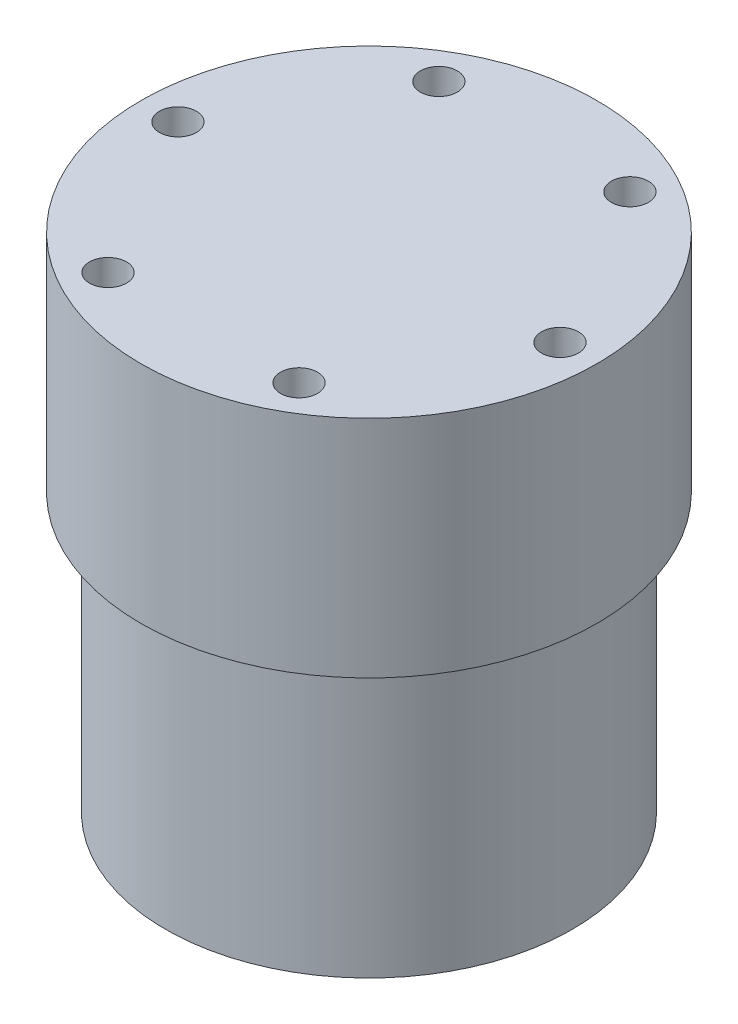
from build123d import *

# Parameters (mm, degrees)
SKETCH1_R           = 16.5
BOSS_EXTRUDE1_DEPTH = 22.5
SKETCH2_R           = 18.5
BOSS_EXTRUDE2_DEPTH = 18.25
SKETCH7_R           = 1.5
CUT_EXTRUDE2_DEPTH  = 6


with BuildPart() as part:
    # Sketch1 → Boss-Extrude1 (new body)
    with BuildSketch(Plane(origin=(0, 0, 0), x_dir=(1, 0, 0), z_dir=(0, 1, 0))):
        with Locations(Location((0, 0, 0), (0, 0, 90))):
            Circle(SKETCH1_R)
    extrude(amount=BOSS_EXTRUDE1_DEPTH)

    # Sketch2 → Boss-Extrude2 (add)
    with BuildSketch(Plane(origin=(0, 22.5, 0), x_dir=(1, 0, 0), z_dir=(0, 1, 0))):
        with Locations(Location((0, 0, 0), (0, 0, 270))):
            Circle(SKETCH2_R)
    extrude(amount=BOSS_EXTRUDE2_DEPTH)

    # Sketch7 → Cut-Extrude2 (cut)
    with BuildSketch(Plane(origin=(0, 40.75, 0), x_dir=(1, 0, 0), z_dir=(0, 1, 0))):
        with Locations(Location((15.5, 0, 0), (0, 0, 270))):
            Circle(SKETCH7_R)
        with Locations(Location((7.75, 13.423393759, 0), (0, 0, 270))):
            Circle(SKETCH7_R)
        with Locations(Location((-15.5, 0, 0), (0, 0, 90))):
            Circle(SKETCH7_R)
        with Locations(Location((-7.75, 13.423393759, 0), (0, 0, 90))):
            Circle(SKETCH7_R)
        with Locations(Location((7.75, -13.423393759, 0), (0, 0, 90))):
            Circle(SKETCH7_R)
        with Locations(Location((-7.75, -13.423393759, 0), (0, 0, 270))):
            Circle(SKETCH7_R)
    extrude(amount=-CUT_EXTRUDE2_DEPTH, mode=Mode.SUBTRACT)


solid = part.part
